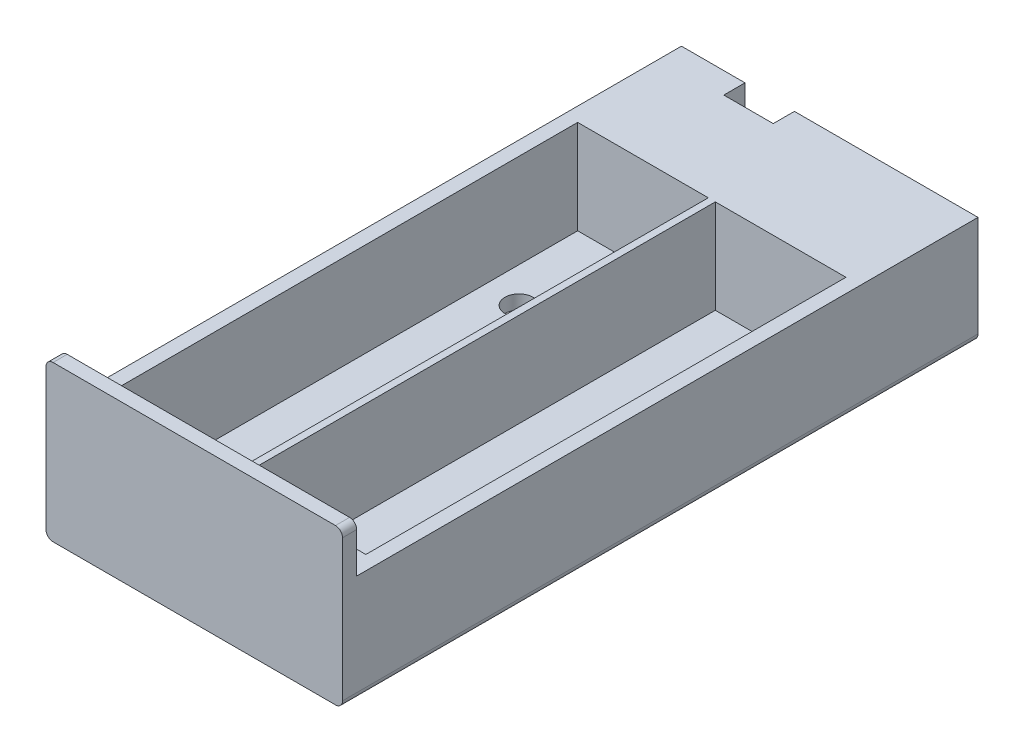
from build123d import *

# Parameters (mm, degrees)
SKETCH1_W           = 42
SKETCH1_H           = 90
BOSS_EXTRUDE1_DEPTH = 22
FILLET1_R           = 1
SKETCH2_W           = 38
SKETCH2_H           = 68
CUT_EXTRUDE1_DEPTH  = 20
SKETCH3_W           = 1
SKETCH3_H           = 68
BOSS_EXTRUDE2_DEPTH = 20
SKETCH4_W           = 42
SKETCH4_H           = 88
CUT_EXTRUDE2_DEPTH  = 6.7
CUT_EXTRUDE3_REACH  = 97
SKETCH5_R           = 1.5
SKETCH6_W           = 7
SKETCH6_H           = 5
CUT_EXTRUDE4_DEPTH  = 3
SKETCH7_R           = 2
CUT_EXTRUDE5_DEPTH  = 55.313902456


with BuildPart() as part:
    # Sketch1 → Boss-Extrude1 (new body)
    with BuildSketch(Plane(origin=(0, 0, 0), x_dir=(1, 0, 0), z_dir=(0, 1, 0))):
        Rectangle(SKETCH1_W, SKETCH1_H)
    extrude(amount=BOSS_EXTRUDE1_DEPTH)

    # Fillet1
    fillet1_edges = [part.edges().sort_by_distance(p)[0] for p in [
        (-21, 22, 0),
        (21, 22, 0),
        (-21, 0, 0),
        (21, 0, 0),
    ]]
    fillet(fillet1_edges, radius=FILLET1_R)

    # Sketch2 → Cut-Extrude1 (cut)
    with BuildSketch(Plane(origin=(0, 22, 0), x_dir=(1, 0, 0), z_dir=(0, 1, 0))):
        with Locations((0, -5.7)):
            Rectangle(SKETCH2_W, SKETCH2_H)
    extrude(amount=-CUT_EXTRUDE1_DEPTH, mode=Mode.SUBTRACT)

    # Sketch3 → Boss-Extrude2 (add)
    with BuildSketch(Plane(origin=(0, 2, 0), x_dir=(1, 0, 0), z_dir=(0, 1, 0))):
        with Locations((0, -5.7)):
            Rectangle(SKETCH3_W, SKETCH3_H)
    extrude(amount=BOSS_EXTRUDE2_DEPTH)

    # Sketch4 → Cut-Extrude2 (cut)
    with BuildSketch(Plane(origin=(0, 22, 0), x_dir=(1, 0, 0), z_dir=(0, 1, 0))):
        with Locations((0, 1)):
            Rectangle(SKETCH4_W, SKETCH4_H)
    extrude(amount=-CUT_EXTRUDE2_DEPTH, mode=Mode.SUBTRACT)

    # Sketch5 → Cut-Extrude3 (cut, up to next)
    with BuildSketch(Plane(origin=(0, 0, -45), x_dir=(-1, 0, 0), z_dir=(0, 0, -1)), mode=Mode.PRIVATE) as cut_extrude3_sk1:
        with Locations((-13.5, 3.5)):
            Circle(SKETCH5_R)
    cut_extrude3_tool1 = extrude(cut_extrude3_sk1.sketch, amount=-CUT_EXTRUDE3_REACH, mode=Mode.PRIVATE) & part.part
    add(cut_extrude3_tool1.solids().sort_by_distance((13.5, 3.5, -45))[0], mode=Mode.SUBTRACT)

    # Sketch6 → Cut-Extrude4 (cut)
    with BuildSketch(Plane(origin=(0, 0, -45), x_dir=(-1, 0, 0), z_dir=(0, 0, -1))):
        with Locations((8.5, 12.8)):
            Rectangle(SKETCH6_W, SKETCH6_H)
    extrude(amount=-CUT_EXTRUDE4_DEPTH, mode=Mode.SUBTRACT)

    # Sketch7 → Cut-Extrude5 (cut, through all)
    with BuildSketch(Plane.XZ):
        with Locations(Location((14, -15, 0), (0, 0, 270))):
            Circle(SKETCH7_R)
        with Locations(Location((14, 25, 0), (0, 0, 270))):
            Circle(SKETCH7_R)
        with Locations(Location((-14, 25, 0), (0, 0, 270))):
            Circle(SKETCH7_R)
        with Locations(Location((-14, -15, 0), (0, 0, 270))):
            Circle(SKETCH7_R)
    extrude(amount=-CUT_EXTRUDE5_DEPTH, mode=Mode.SUBTRACT)


solid = part.part
